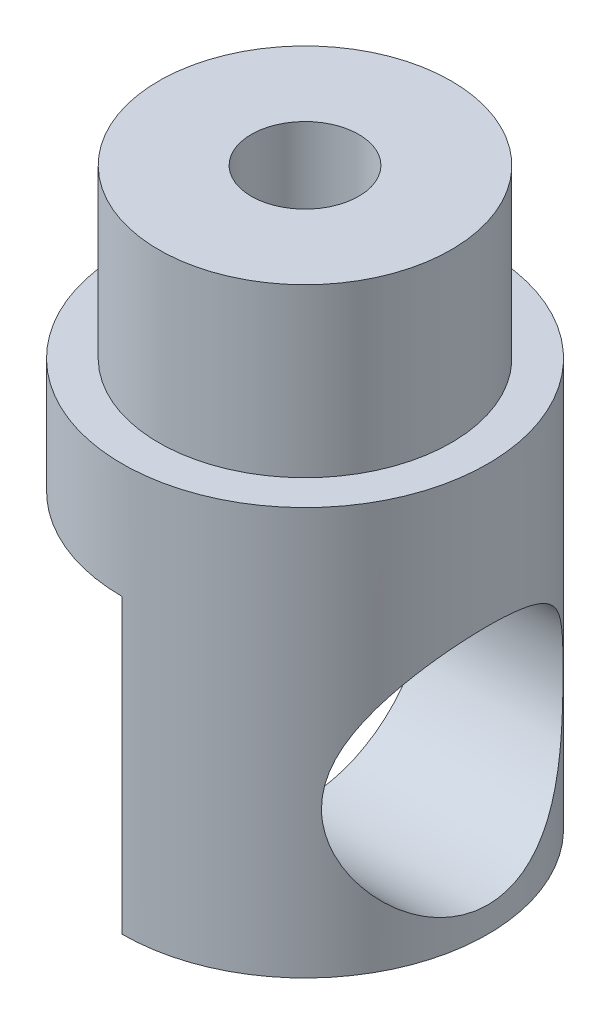
from build123d import *

# Parameters (mm, degrees)
CROQUIS1_R                     = 11.1125
SALIENTE_EXTRUIR1_DEPTH        = 34.925
CORTAR_EXTRUIR2_START          = 10.16
CROQUIS12_R                    = 11.1125
CROQUIS12_R_2                  = 8.89
CORTAR_EXTRUIR2_DEPTH          = 10.16
TALADRO_ROSCADO_5_16_181_D     = 6.5278
TALADRO_ROSCADO_5_16_181_DEPTH = 12.7
TALADRO_ROSCADO_5_16_181_TIP   = 1.961148974
CROQUIS6_W                     = 22.225
CROQUIS6_H                     = 17.78
CORTAR_EXTRUIR1_DEPTH          = 25.4
TALADRO_ROSCADO_5_8_181_D      = 14.68374
TALADRO_ROSCADO_5_8_181_DEPTH  = 38.7985
TALADRO_ROSCADO_5_8_181_TIP    = 4.411440553


with BuildPart() as part:
    # Croquis1 → Saliente-Extruir1 (new body)
    with BuildSketch(Plane(origin=(0, 0, 0), x_dir=(1, 0, 0), z_dir=(0, 1, 0))):
        with Locations(Location((0, 0, 0), (0, 0, 270))):
            Circle(CROQUIS1_R)
    extrude(amount=SALIENTE_EXTRUIR1_DEPTH)

    # Croquis12 → Cortar-Extruir2 (cut)
    with BuildSketch(Plane.XZ.offset(-34.925).offset(CORTAR_EXTRUIR2_START)):
        with Locations(Location((0, 0, 0), (0, 0, 270))):
            Circle(CROQUIS12_R)
        with Locations(Location((0, 0, 0), (0, 0, 270))):
            Circle(CROQUIS12_R_2, mode=Mode.SUBTRACT)
    extrude(amount=-CORTAR_EXTRUIR2_DEPTH, mode=Mode.SUBTRACT)

    # Taladro roscado 5/16-181
    with Locations(Plane(origin=(0, 34.925, 0), x_dir=(1, 0, 0), z_dir=(0, 1, 0))):
        with Locations((0, 0)):
            Hole(TALADRO_ROSCADO_5_16_181_D / 2, depth=TALADRO_ROSCADO_5_16_181_DEPTH)
            with Locations((0, 0, -(TALADRO_ROSCADO_5_16_181_DEPTH + TALADRO_ROSCADO_5_16_181_TIP / 2))):  # 118° drill point
                Cone(0, TALADRO_ROSCADO_5_16_181_D / 2, TALADRO_ROSCADO_5_16_181_TIP, mode=Mode.SUBTRACT)

    # Croquis6 → Cortar-Extruir1 (cut)
    with BuildSketch(Plane(origin=(0, 0, 0), x_dir=(0, 0, -1), z_dir=(1, 0, 0))):
        with Locations((0, 8.89)):
            Rectangle(CROQUIS6_W, CROQUIS6_H)
    extrude(amount=-CORTAR_EXTRUIR1_DEPTH, mode=Mode.SUBTRACT)

    # Taladro roscado 5/8-181
    with Locations(Plane.ZY):
        with Locations((0, 8.89)):
            Hole(TALADRO_ROSCADO_5_8_181_D / 2, depth=TALADRO_ROSCADO_5_8_181_DEPTH)
            with Locations((0, 0, -(TALADRO_ROSCADO_5_8_181_DEPTH + TALADRO_ROSCADO_5_8_181_TIP / 2))):  # 118° drill point
                Cone(0, TALADRO_ROSCADO_5_8_181_D / 2, TALADRO_ROSCADO_5_8_181_TIP, mode=Mode.SUBTRACT)


solid = part.part
